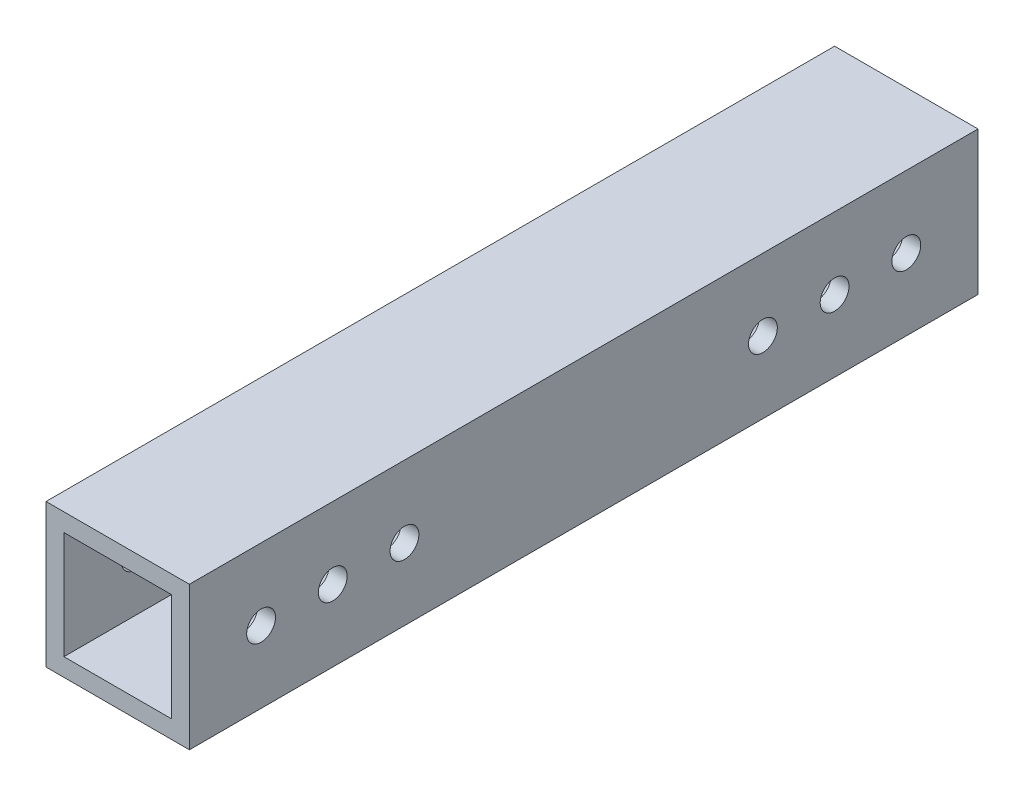
from build123d import *

# Parameters (mm, degrees)
SKETCH1_W              = 25.4
SKETCH1_H              = 25.4
SKETCH1_W_2            = 19.05
SKETCH1_H_2            = 19.05
EXTRUDE_THIN1_DEPTH    = 139.7
F_10_CLEARANCE_HOLE1_D = 5.1054
F_10_CLEARANCE_HOLE2_D = 5.1054


with BuildPart() as part:
    # Sketch1 → Extrude-Thin1 (new body)
    with BuildSketch(Plane.XY):
        with Locations((-12.7, 12.7)):
            Rectangle(SKETCH1_W, SKETCH1_H)
        with Locations((-12.7, 12.7)):
            Rectangle(SKETCH1_W_2, SKETCH1_H_2, mode=Mode.SUBTRACT)
    extrude(amount=EXTRUDE_THIN1_DEPTH)

    # #10 Clearance Hole1 (through all)
    with Locations(Plane(origin=(0, 0, 0), x_dir=(0, 0, -1), z_dir=(1, 0, 0))):
        with Locations((-12.7, 12.7), (-25.4, 12.7), (-38.1, 12.7)):
            Hole(F_10_CLEARANCE_HOLE1_D / 2)

    # #10 Clearance Hole2 (through all)
    with Locations(Plane.ZY.offset(25.4)):
        with Locations((114.3, 12.7), (127, 12.7), (101.6, 12.7)):
            Hole(F_10_CLEARANCE_HOLE2_D / 2)


solid = part.part
